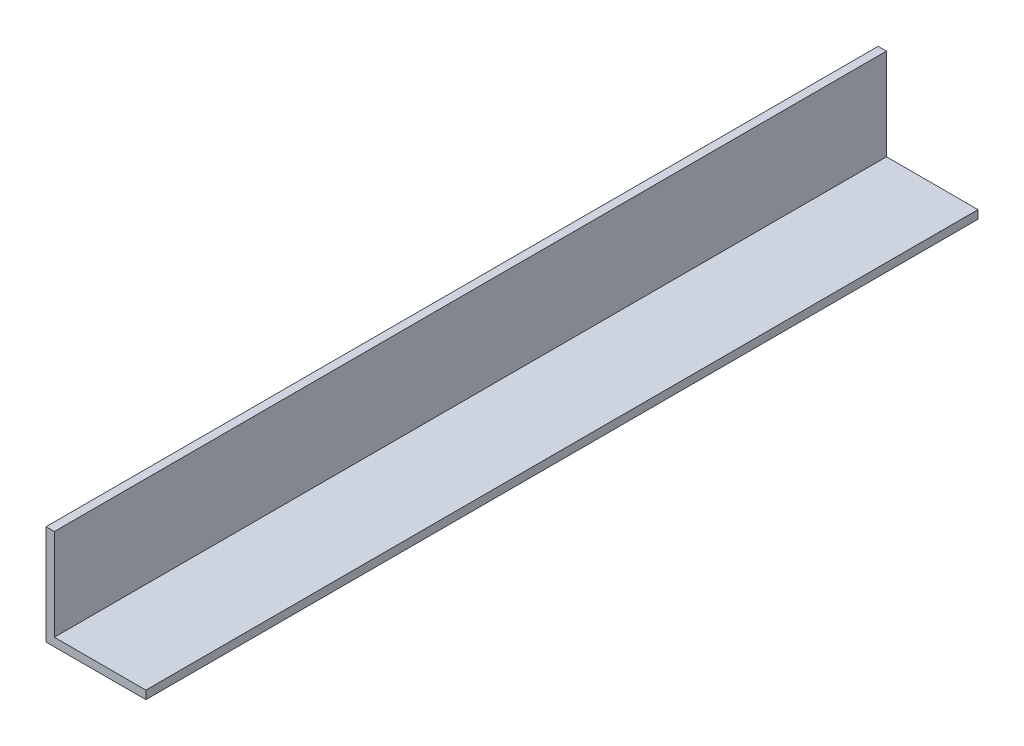
from build123d import *

# Parameters (mm, degrees)
SALIENTE_EXTRUIR1_DEPTH = 50


with BuildPart() as part:
    # Croquis1 → Saliente-Extruir1 (new body)
    with BuildSketch(Plane.XY):
        Polygon((-3, 3), (-3, -3), (3, -3), (3, -2.5), (-2.5, -2.5), (-2.5, 3), align=None)
    extrude(amount=SALIENTE_EXTRUIR1_DEPTH)


solid = part.part
